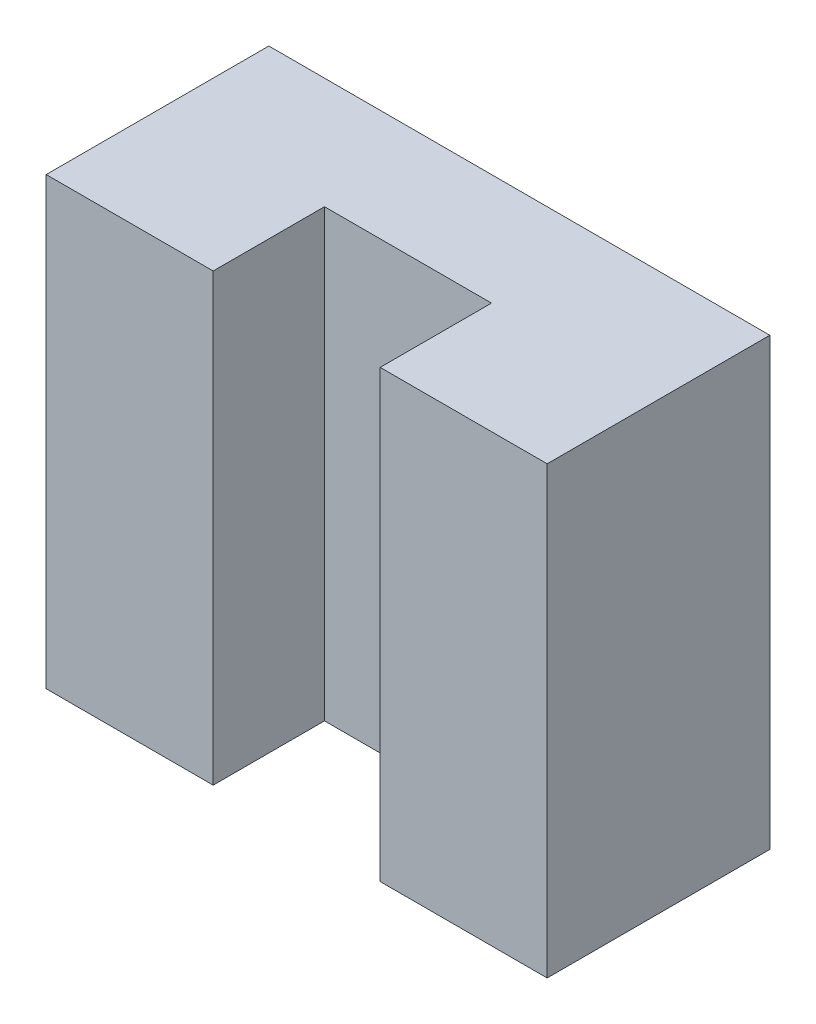
from build123d import *

# Parameters (mm, degrees)
BOSS_EXTRUDE1_DEPTH = 80


with BuildPart() as part:
    # Sketch1 → Boss-Extrude1 (new body)
    with BuildSketch(Plane(origin=(0, 0, 0), x_dir=(1, 0, 0), z_dir=(0, 1, 0))):
        Polygon((60, 0), (90, 0), (90, 40), (0, 40), (0, 0), (30, 0), (30, 20), (60, 20), align=None)
    extrude(amount=BOSS_EXTRUDE1_DEPTH)


solid = part.part
